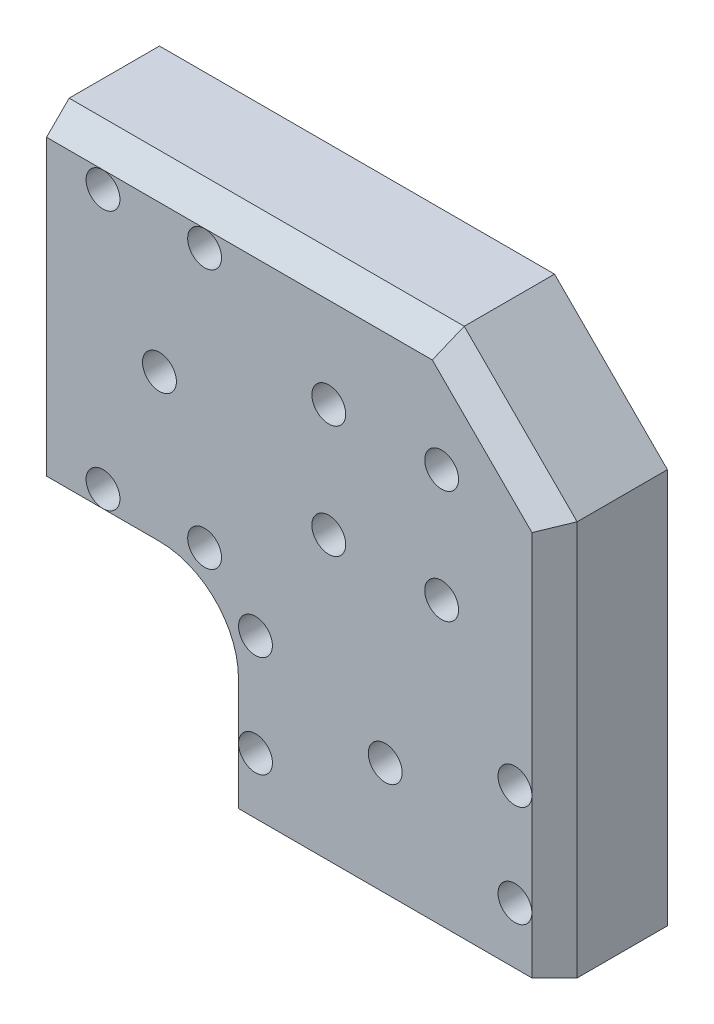
from build123d import *

# Parameters (mm, degrees)
BOSS_EXTRUDE1_DEPTH = 10
CUT_EXTRUDE1_DEPTH  = 20
CUT_EXTRUDE2_DEPTH  = 20
CUT_EXTRUDE3_DEPTH  = 20
SKETCH5_R           = 1.5
CUT_EXTRUDE4_DEPTH  = 20
FILLET1_R           = 5
CHAMFER1_SIZE       = 2
SKETCH6_R           = 1.5
CUT_EXTRUDE5_DEPTH  = 20


with BuildPart() as part:
    # Sketch1 → Boss-Extrude1 (new body)
    with BuildSketch(Plane.XY):
        Polygon((-30, -15), (-15, -15), (-15, -30), (15, -30), (15, 5), (5, 15), (-30, 15), align=None)
        with BuildLine():
            Line((-3.5, 5), (-6.5, 5))
            ThreePointArc((-6.5, 5), (-5, 6.5), (-3.5, 5))
        make_face(mode=Mode.SUBTRACT)
        with BuildLine():
            ThreePointArc((3.5, 5), (5, 6.5), (6.5, 5))
            Line((6.5, 5), (3.5, 5))
        make_face(mode=Mode.SUBTRACT)
    extrude(amount=BOSS_EXTRUDE1_DEPTH)

    # Sketch2 → Cut-Extrude1 (cut)
    with BuildSketch(Plane.XZ.offset(30)):
        with BuildLine():
            Line((0, 0), (7.984359711, 0))
            ThreePointArc((7.984359711, 0), (0, 7.5), (-7.984359711, 0))
            Line((-7.984359711, 0), (0, 0))
        make_face()
    extrude(amount=-CUT_EXTRUDE1_DEPTH, mode=Mode.SUBTRACT)

    # Sketch3 → Cut-Extrude2 (cut)
    with BuildSketch(Plane.ZY.offset(30)):
        with BuildLine():
            ThreePointArc((0, -7.984359711), (5.330951895, -5.477225575), (7.5, 0))
            ThreePointArc((7.5, 0), (5.330951895, 5.477225575), (0, 7.984359711))
            Line((0, 7.984359711), (0, 0))
            Line((0, 0), (0, -7.984359711))
        make_face()
    extrude(amount=-CUT_EXTRUDE2_DEPTH, mode=Mode.SUBTRACT)

    # Sketch4 → Cut-Extrude3 (cut)
    with BuildSketch(Plane(origin=(0, 0, 0), x_dir=(-1, 0, 0), z_dir=(0, 0, -1))):
        with BuildLine():
            ThreePointArc((3.5, 5), (5, 6.5), (6.5, 5))
            Line((6.5, 5), (3.5, 5))
        make_face()
        with BuildLine():
            Line((5, 5), (3.5, 5))
            ThreePointArc((3.5, 5), (3.939339828, 3.939339828), (5, 3.5))
            Line((5, 3.5), (5, 5))
        make_face()
        with BuildLine():
            Line((5, 5), (5, 3.5))
            ThreePointArc((5, 3.5), (6.060660172, 3.939339828), (6.5, 5))
            Line((6.5, 5), (5, 5))
        make_face()
        with BuildLine():
            Line((5, 5), (3.5, 5))
            ThreePointArc((3.5, 5), (3.939339828, 3.939339828), (5, 3.5))
            Line((5, 3.5), (5, 5))
        make_face()
        with BuildLine():
            Line((5, 5), (5, 3.5))
            ThreePointArc((5, 3.5), (6.060660172, 3.939339828), (6.5, 5))
            Line((6.5, 5), (5, 5))
        make_face()
        with BuildLine():
            ThreePointArc((5, -3.5), (3.939339828, -3.939339828), (3.5, -5))
            Line((3.5, -5), (5, -5))
            Line((5, -5), (5, -3.5))
        make_face()
        with BuildLine():
            Line((5, -5), (3.5, -5))
            ThreePointArc((3.5, -5), (5, -6.5), (6.5, -5))
            ThreePointArc((6.5, -5), (6.060660172, -3.939339828), (5, -3.5))
            Line((5, -3.5), (5, -5))
        make_face()
        with BuildLine():
            ThreePointArc((5, -3.5), (3.939339828, -3.939339828), (3.5, -5))
            Line((3.5, -5), (5, -5))
            Line((5, -5), (5, -3.5))
        make_face()
        with BuildLine():
            Line((5, -5), (3.5, -5))
            ThreePointArc((3.5, -5), (5, -6.5), (6.5, -5))
            ThreePointArc((6.5, -5), (6.060660172, -3.939339828), (5, -3.5))
            Line((5, -3.5), (5, -5))
        make_face()
        with BuildLine():
            Line((-5, 6.5), (-5, 5))
            Line((-5, 5), (-3.5, 5))
            ThreePointArc((-3.5, 5), (-3.939339828, 6.060660172), (-5, 6.5))
        make_face()
        with BuildLine():
            Line((-6.5, 5), (-5, 5))
            Line((-5, 5), (-5, 6.5))
            ThreePointArc((-5, 6.5), (-6.060660172, 6.060660172), (-6.5, 5))
        make_face()
        with BuildLine():
            Line((-5, 6.5), (-5, 5))
            Line((-5, 5), (-3.5, 5))
            ThreePointArc((-3.5, 5), (-3.939339828, 6.060660172), (-5, 6.5))
        make_face()
        with BuildLine():
            Line((-6.5, 5), (-5, 5))
            Line((-5, 5), (-5, 6.5))
            ThreePointArc((-5, 6.5), (-6.060660172, 6.060660172), (-6.5, 5))
        make_face()
        with BuildLine():
            ThreePointArc((-6.5, 5), (-6.060660172, 3.939339828), (-5, 3.5))
            Line((-5, 3.5), (-5, 5))
            Line((-5, 5), (-6.5, 5))
        make_face()
        with BuildLine():
            Line((-5, 5), (-5, 3.5))
            ThreePointArc((-5, 3.5), (-3.939339828, 3.939339828), (-3.5, 5))
            Line((-3.5, 5), (-5, 5))
        make_face()
        with BuildLine():
            ThreePointArc((-6.5, 5), (-6.060660172, 3.939339828), (-5, 3.5))
            Line((-5, 3.5), (-5, 5))
            Line((-5, 5), (-6.5, 5))
        make_face()
        with BuildLine():
            Line((-5, 5), (-5, 3.5))
            ThreePointArc((-5, 3.5), (-3.939339828, 3.939339828), (-3.5, 5))
            Line((-3.5, 5), (-5, 5))
        make_face()
        with BuildLine():
            Line((-5, -6.5), (-5, -5))
            Line((-5, -5), (-5, -3.5))
            ThreePointArc((-5, -3.5), (-6.5, -5), (-5, -6.5))
        make_face()
        with BuildLine():
            Line((-5, -3.5), (-5, -5))
            Line((-5, -5), (-3.5, -5))
            ThreePointArc((-3.5, -5), (-3.939339828, -3.939339828), (-5, -3.5))
        make_face()
        with BuildLine():
            Line((-3.5, -5), (-5, -5))
            Line((-5, -5), (-5, -6.5))
            ThreePointArc((-5, -6.5), (-3.939339828, -6.060660172), (-3.5, -5))
        make_face()
        with BuildLine():
            Line((-5, -3.5), (-5, -5))
            Line((-5, -5), (-3.5, -5))
            ThreePointArc((-3.5, -5), (-3.939339828, -3.939339828), (-5, -3.5))
        make_face()
        with BuildLine():
            Line((-3.5, -5), (-5, -5))
            Line((-5, -5), (-5, -6.5))
            ThreePointArc((-5, -6.5), (-3.939339828, -6.060660172), (-3.5, -5))
        make_face()
    extrude(amount=-CUT_EXTRUDE3_DEPTH, mode=Mode.SUBTRACT)

    # Sketch5 → Cut-Extrude4 (cut)
    with BuildSketch(Plane(origin=(0, 0, 0), x_dir=(-1, 0, 0), z_dir=(0, 0, -1))):
        with Locations((25, 11.492179856)):
            Circle(SKETCH5_R)
        with Locations((16, 11.492179856)):
            Circle(SKETCH5_R)
        with Locations((25, -11.492179856)):
            Circle(SKETCH5_R)
        with Locations((16, -11.492179856)):
            Circle(SKETCH5_R)
        with Locations((11.492179856, -16)):
            Circle(SKETCH5_R)
        with Locations((11.492179856, -25)):
            Circle(SKETCH5_R)
        with Locations(Location((-11.492179856, -16, 0), (0, 0, 180))):
            Circle(SKETCH5_R)
        with Locations((-11.492179856, -25)):
            Circle(SKETCH5_R)
    extrude(amount=-CUT_EXTRUDE4_DEPTH, mode=Mode.SUBTRACT)

    # Fillet1
    fillet1_edges = [part.edges().sort_by_distance(p)[0] for p in [
        (-15, -15, 5),
    ]]
    fillet(fillet1_edges, radius=FILLET1_R)

    # Chamfer1
    chamfer1_edges = [part.edges().sort_by_distance(p)[0] for p in [
        (-16.464466094, -16.464466094, 10),
        (-16.464466094, -16.464466094, 0),
        (-25, -15, 0),
        (15, -12.5, 10),
        (10, 10, 10),
        (-12.5, 15, 10),
        (-15, -25, 10),
        (-15, -25, 0),
        (-25, -15, 10),
    ]]
    chamfer(chamfer1_edges, length=CHAMFER1_SIZE)

    # Sketch6 → Cut-Extrude5 (cut)
    with BuildSketch(Plane.XY.offset(10)):
        with Locations((-20, 0)):
            Circle(SKETCH6_R)
        with Locations((0, -20)):
            Circle(SKETCH6_R)
    extrude(amount=-CUT_EXTRUDE5_DEPTH, mode=Mode.SUBTRACT)


solid = part.part
